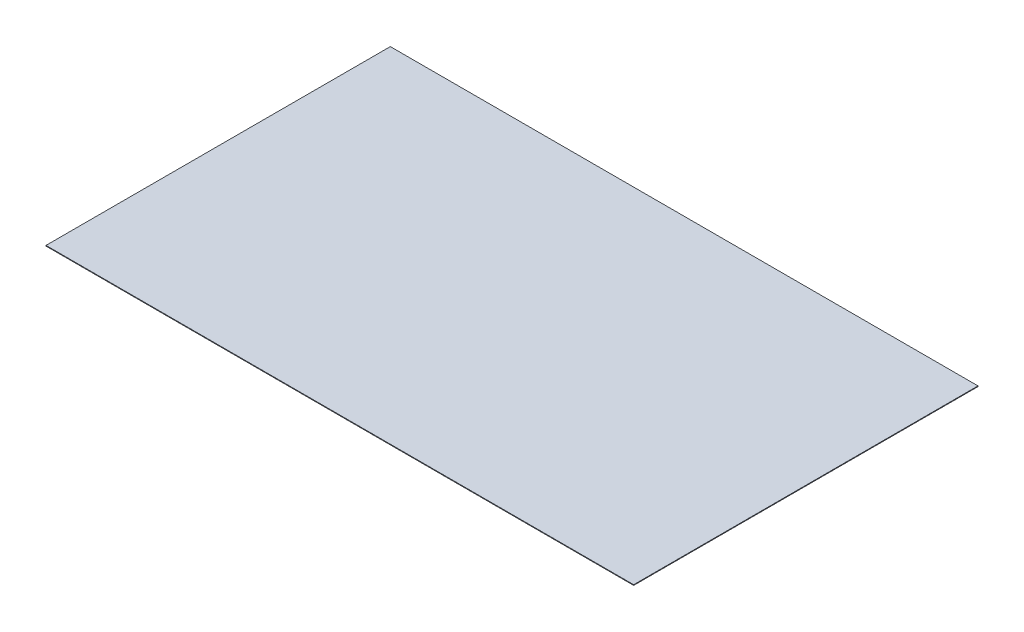
from build123d import *

# Parameters (mm, degrees)
SKETCH1_W             = 1397
SKETCH1_H             = 1.5
STORE_DIS_ALT_1_DEPTH = 818.5


with BuildPart() as part:
    # Sketch1 → STORE_dis_alt_1 (new body)
    with BuildSketch(Plane.XY):
        with Locations((700, 120.75)):
            Rectangle(SKETCH1_W, SKETCH1_H)
    extrude(amount=-STORE_DIS_ALT_1_DEPTH)


solid = part.part
